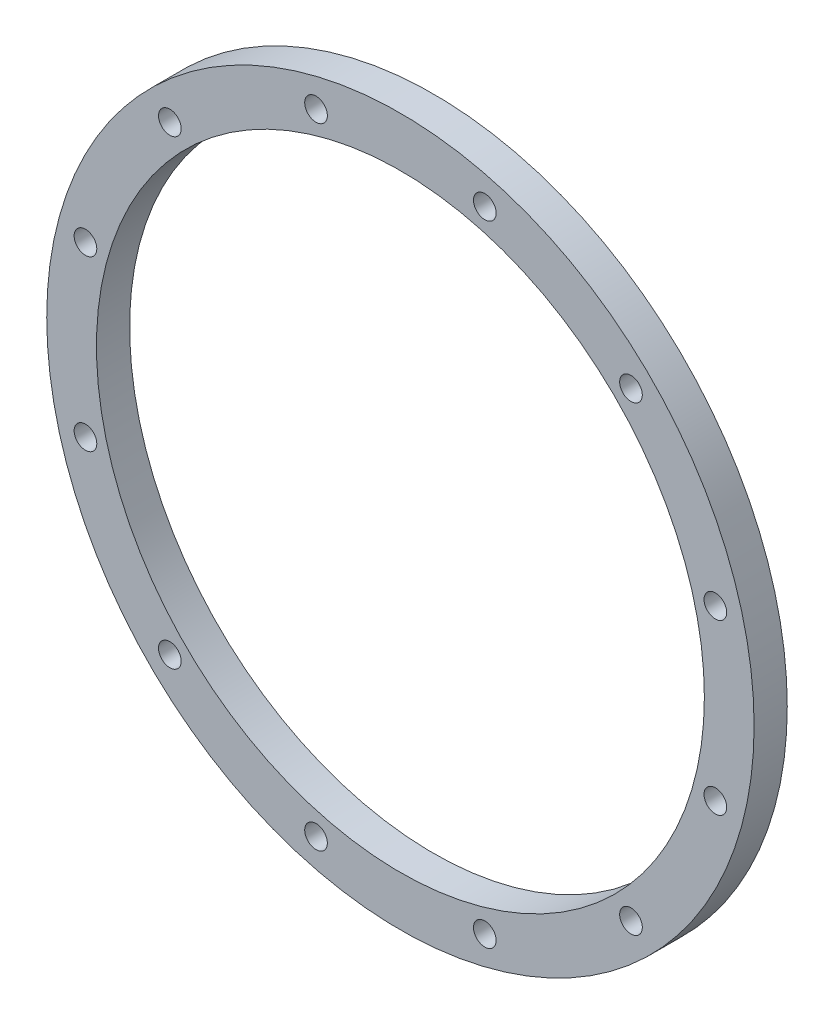
from build123d import *

# Parameters (mm, degrees)
SKETCH1_R           = 64
SKETCH1_R_2         = 55
SKETCH1_R_3         = 2.05
BOSS_EXTRUDE1_DEPTH = 6


with BuildPart() as part:
    # Sketch1 → Boss-Extrude1 (new body)
    with BuildSketch(Plane.XY):
        with Locations((-89.072792821, 47.25870832)):
            Circle(SKETCH1_R)
        with Locations((-89.072792821, 47.25870832)):
            Circle(SKETCH1_R_2, mode=Mode.SUBTRACT)
        with Locations((-32.08316907, 62.529031982)):
            Circle(SKETCH1_R_3, mode=Mode.SUBTRACT)
        with Locations((-32.08316907, 31.988384659)):
            Circle(SKETCH1_R_3, mode=Mode.SUBTRACT)
        with Locations((-47.353492731, 5.53940823)):
            Circle(SKETCH1_R_3, mode=Mode.SUBTRACT)
        with Locations((-73.80246916, -9.730915431)):
            Circle(SKETCH1_R_3, mode=Mode.SUBTRACT)
        with Locations((-104.343116482, -9.730915431)):
            Circle(SKETCH1_R_3, mode=Mode.SUBTRACT)
        with Locations((-130.792092911, 5.53940823)):
            Circle(SKETCH1_R_3, mode=Mode.SUBTRACT)
        with Locations((-146.062416572, 31.988384659)):
            Circle(SKETCH1_R_3, mode=Mode.SUBTRACT)
        with Locations((-146.062416572, 62.529031982)):
            Circle(SKETCH1_R_3, mode=Mode.SUBTRACT)
        with Locations((-130.792092911, 88.978008411)):
            Circle(SKETCH1_R_3, mode=Mode.SUBTRACT)
        with Locations((-104.343116482, 104.248332072)):
            Circle(SKETCH1_R_3, mode=Mode.SUBTRACT)
        with Locations((-73.80246916, 104.248332072)):
            Circle(SKETCH1_R_3, mode=Mode.SUBTRACT)
        with Locations((-47.353492731, 88.978008411)):
            Circle(SKETCH1_R_3, mode=Mode.SUBTRACT)
    extrude(amount=BOSS_EXTRUDE1_DEPTH)


solid = part.part
